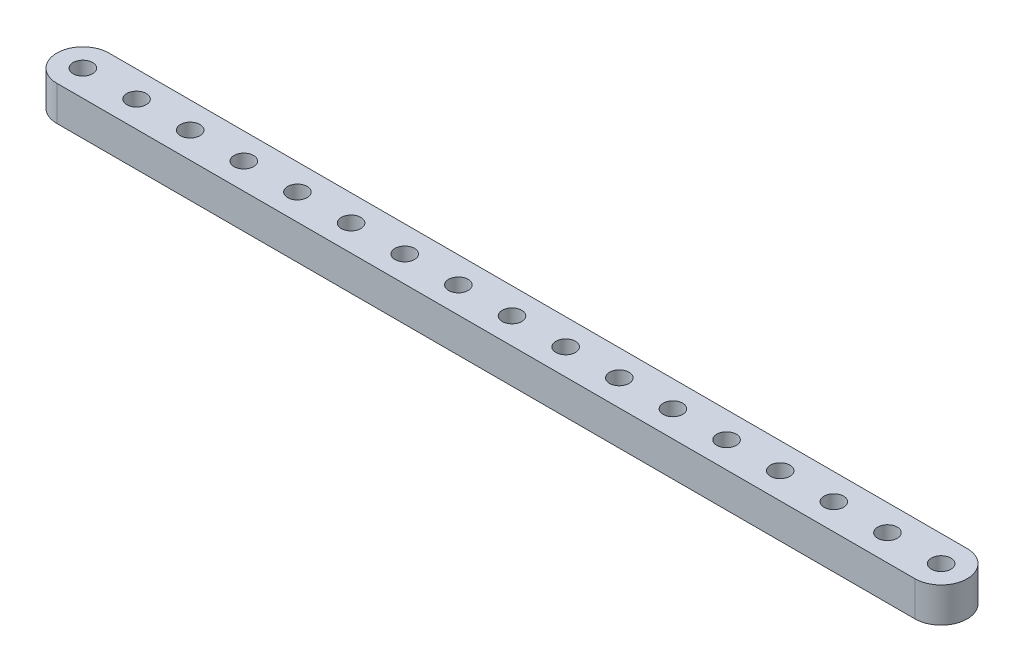
from build123d import *

# Parameters (mm, degrees)
SKETCH1_R           = 1.778
BOSS_EXTRUDE1_DEPTH = 6.35


with BuildPart() as part:
    # Sketch1 → Boss-Extrude1 (new body)
    with BuildSketch(Plane(origin=(0, 6.35, 0), x_dir=(1, 0, 0), z_dir=(0, 1, 0))):
        with BuildLine():
            Line((78.232, 4.7625), (-78.232, 4.7625))
            ThreePointArc((-78.232, 4.7625), (-82.9945, 0), (-78.232, -4.7625))
            Line((-78.232, -4.7625), (78.232, -4.7625))
            ThreePointArc((78.232, -4.7625), (82.9945, 0), (78.232, 4.7625))
        make_face()
        with Locations(Location((78.232, 0, 0), (0, 0, 90))):
            Circle(SKETCH1_R, mode=Mode.SUBTRACT)
        with Locations(Location((68.453, 0, 0), (0, 0, 90))):
            Circle(SKETCH1_R, mode=Mode.SUBTRACT)
        with Locations(Location((58.674, 0, 0), (0, 0, 90))):
            Circle(SKETCH1_R, mode=Mode.SUBTRACT)
        with Locations(Location((48.895, 0, 0), (0, 0, 90))):
            Circle(SKETCH1_R, mode=Mode.SUBTRACT)
        with Locations(Location((39.116, 0, 0), (0, 0, 90))):
            Circle(SKETCH1_R, mode=Mode.SUBTRACT)
        with Locations(Location((29.337, 0, 0), (0, 0, 90))):
            Circle(SKETCH1_R, mode=Mode.SUBTRACT)
        with Locations(Location((19.558, 0, 0), (0, 0, 90))):
            Circle(SKETCH1_R, mode=Mode.SUBTRACT)
        with Locations(Location((9.779, 0, 0), (0, 0, 90))):
            Circle(SKETCH1_R, mode=Mode.SUBTRACT)
        with Locations(Location((0, 0, 0), (0, 0, 90))):
            Circle(SKETCH1_R, mode=Mode.SUBTRACT)
        with Locations(Location((-9.779, 0, 0), (0, 0, 90))):
            Circle(SKETCH1_R, mode=Mode.SUBTRACT)
        with Locations(Location((-19.558, 0, 0), (0, 0, 90))):
            Circle(SKETCH1_R, mode=Mode.SUBTRACT)
        with Locations(Location((-29.337, 0, 0), (0, 0, 90))):
            Circle(SKETCH1_R, mode=Mode.SUBTRACT)
        with Locations(Location((-39.116, 0, 0), (0, 0, 90))):
            Circle(SKETCH1_R, mode=Mode.SUBTRACT)
        with Locations(Location((-48.895, 0, 0), (0, 0, 90))):
            Circle(SKETCH1_R, mode=Mode.SUBTRACT)
        with Locations(Location((-58.674, 0, 0), (0, 0, 90))):
            Circle(SKETCH1_R, mode=Mode.SUBTRACT)
        with Locations(Location((-68.453, 0, 0), (0, 0, 90))):
            Circle(SKETCH1_R, mode=Mode.SUBTRACT)
        with Locations(Location((-78.232, 0, 0), (0, 0, 90))):
            Circle(SKETCH1_R, mode=Mode.SUBTRACT)
    extrude(amount=-BOSS_EXTRUDE1_DEPTH)


solid = part.part
